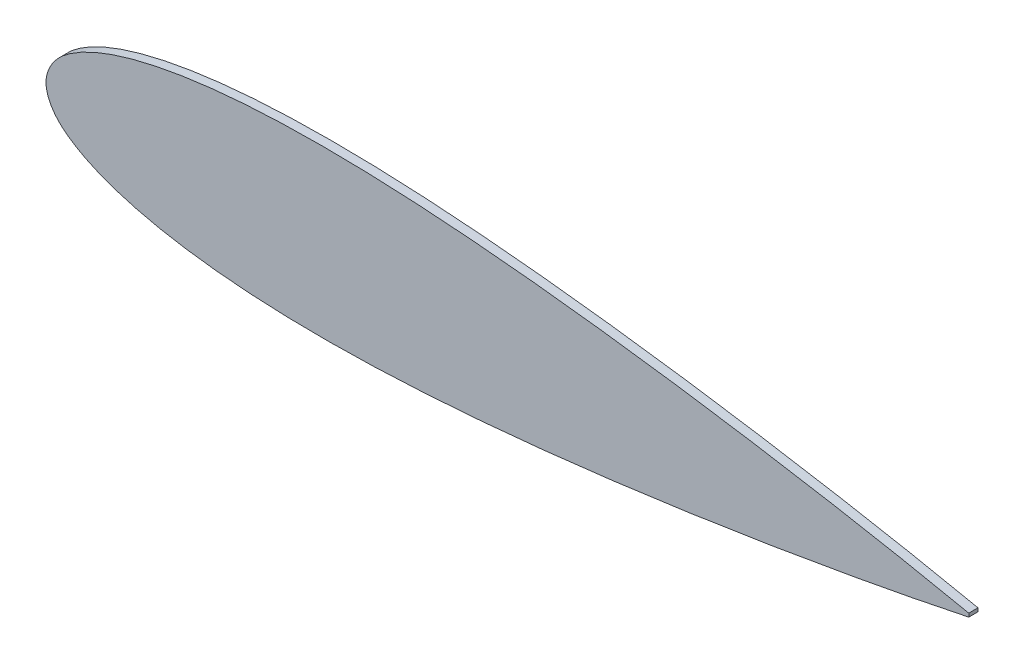
from build123d import *

# Parameters (mm, degrees)
BOSS_EXTRUDE1_DEPTH = 0.01


with BuildPart() as part:
    # Sketch1 → Boss-Extrude1 (new body)
    with BuildSketch(Plane.XY):
        with BuildLine():
            Line((1, 0.00189), (1, -0.00189))
            add(Edge.make_bspline(
                [(1, 0.00189), (0.983341446, 0.005333831), (0.950061799, 0.012213748), (0.883441372, 0.024978318), (0.800162879, 0.039656742), (0.700149964, 0.055281688), (0.600152498, 0.068842889), (0.500153663, 0.079934172), (0.400130752, 0.087795052), (0.316680277, 0.090587286), (0.249959662, 0.089472879), (0.199878691, 0.086507307), (0.149703565, 0.080781722), (0.10794307, 0.07278077), (0.074635308, 0.063264864), (0.049199657, 0.053650936), (0.027894571, 0.042073817), (0.008297026, 0.026061248), (-0.005414273, 0), (0.008297026, -0.026061248), (0.027894571, -0.042073817), (0.049199657, -0.053650936), (0.074635308, -0.063264864), (0.10794307, -0.07278077), (0.149703565, -0.080781722), (0.199878691, -0.086507307), (0.249959662, -0.089472879), (0.316680277, -0.090587286), (0.400130752, -0.087795052), (0.500153663, -0.079934172), (0.600152498, -0.068842889), (0.700149964, -0.055281688), (0.800162879, -0.039656742), (0.883441372, -0.024978318), (0.950061799, -0.012213748), (0.983341446, -0.005333831), (1, -0.00189)],
                knots=[0, 0, 0, 0, 0.024603844, 0.049152359, 0.098108667, 0.146905312, 0.195554797, 0.244056277, 0.292409554, 0.340643731, 0.364754111, 0.3889056, 0.413178108, 0.437756239, 0.450304697, 0.463229879, 0.477067953, 0.485035559, 0.5, 0.514964441, 0.522932047, 0.536770121, 0.549695303, 0.562243761, 0.586821892, 0.6110944, 0.635245889, 0.659356269, 0.707590446, 0.755943723, 0.804445203, 0.853094688, 0.901891333, 0.950847641, 0.975396156, 1, 1, 1, 1], degree=3))
        make_face()
    extrude(amount=BOSS_EXTRUDE1_DEPTH)


solid = part.part
